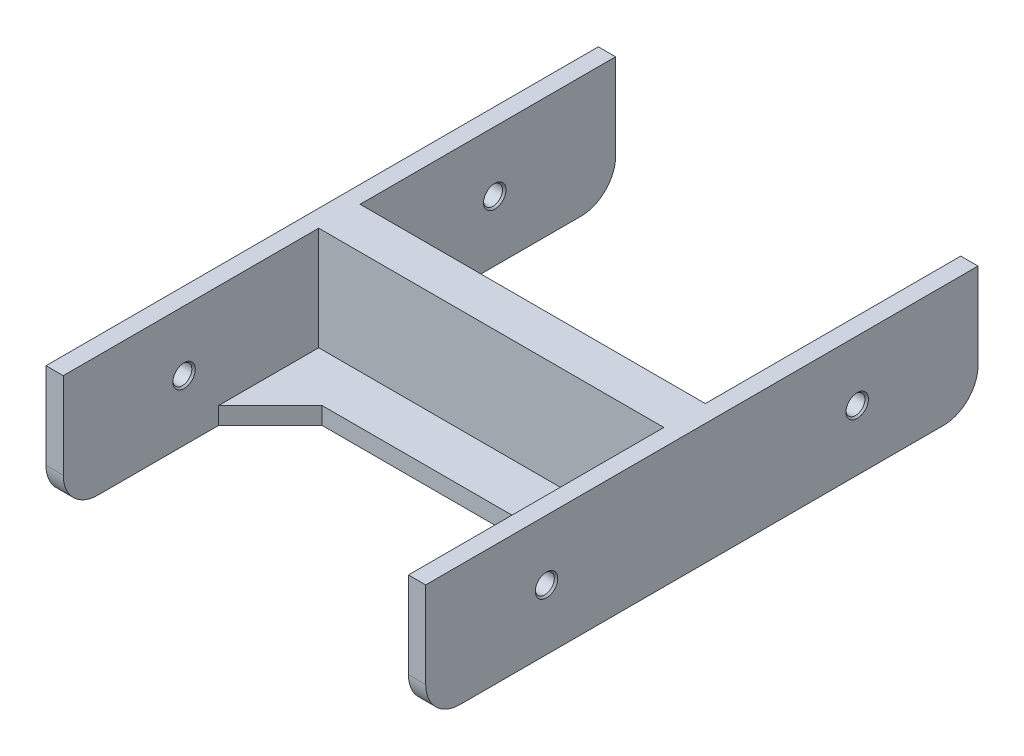
from build123d import *

# Parameters (mm, degrees)
SKETCH_1_W          = 160
SKETCH_1_H          = 20
EXTRUDE_1_DEPTH     = 5
EXTRUDE_3_DEPTH     = 100
SKETCH_5_W          = 12
SKETCH_5_H          = 15
EXTRUDE_4_DEPTH     = 105
SKETCH_6_W          = 74
SKETCH_6_H          = 15
EXTRUDE_5_DEPTH     = 5
SKETCH_7_W          = 160
SKETCH_7_H          = 35
EXTRUDE_6_DEPTH     = 5
EXTRUDE_7_DEPTH     = 5
SKETCH_9_R          = 2.75
CUT_EXTRUDE_1_DEPTH = 138.477270849
CHAMFER_1_SIZE      = 0.5
FILLET_1_R          = 10


with BuildPart() as part:
    # 草图1 → 凸台-拉伸1 (new body)
    with BuildSketch(Plane(origin=(0, 0, 0), x_dir=(0, 0, -1), z_dir=(1, 0, 0))):
        with Locations((0, -5)):
            Rectangle(SKETCH_1_W, SKETCH_1_H)
    extrude(amount=EXTRUDE_1_DEPTH)

    # 草图3 → 凸台-拉伸3 (add)
    with BuildSketch(Plane(origin=(5, 0, 0), x_dir=(0, 0, -1), z_dir=(1, 0, 0))):
        Polygon((-6, 5), (6, 5), (6, -10), (20, -10), (20, -15), (-20, -15), (-20, -10), (-6, -10), align=None)
    extrude(amount=EXTRUDE_3_DEPTH)

    # 草图5 → 凸台-拉伸4 (add)
    with BuildSketch(Plane.ZY):
        with Locations((0, 12.5)):
            Rectangle(SKETCH_5_W, SKETCH_5_H)
    extrude(amount=-EXTRUDE_4_DEPTH)

    # 草图6 → 凸台-拉伸5 (add)
    with BuildSketch(Plane.ZY):
        with Locations((43, 12.5)):
            Rectangle(SKETCH_6_W, SKETCH_6_H)
        with Locations((-43, 12.5)):
            Rectangle(SKETCH_6_W, SKETCH_6_H)
    extrude(amount=-EXTRUDE_5_DEPTH)

    # 草图7 → 凸台-拉伸6 (add)
    with BuildSketch(Plane(origin=(105, 0, 0), x_dir=(0, 0, -1), z_dir=(1, 0, 0))):
        with Locations((0, 2.5)):
            Rectangle(SKETCH_7_W, SKETCH_7_H)
    extrude(amount=EXTRUDE_6_DEPTH)

    # 草图8 → 凸台-拉伸7 (add)
    with BuildSketch(Plane.XZ.offset(15)):
        Polygon((90, 20), (105, 35), (105, 20), align=None)
        Polygon((105, -20), (90, -20), (105, -35), align=None)
        Polygon((5, 20), (20, 20), (5, 35), align=None)
        Polygon((20, -20), (5, -35), (5, -20), align=None)
    extrude(amount=-EXTRUDE_7_DEPTH)

    # 草图9 → 切除-拉伸1 (cut, through all)
    with BuildSketch(Plane(origin=(110, 0, 0), x_dir=(0, 0, -1), z_dir=(1, 0, 0))):
        with Locations((45, 2.5)):
            Circle(SKETCH_9_R)
        with Locations(Location((-45, 2.5, 0), (0, 0, 180))):
            Circle(SKETCH_9_R)
    extrude(amount=-CUT_EXTRUDE_1_DEPTH, mode=Mode.SUBTRACT)

    # 倒角1
    chamfer_1_edges = [part.edges().sort_by_distance(p)[0] for p in [
        (105, 2.5, -42.25),
        (5, 2.5, -42.25),
        (0, 2.5, -42.25),
        (110, 2.5, -42.25),
        (105, 2.5, 42.25),
        (5, 2.5, 42.25),
        (0, 2.5, 42.25),
        (110, 2.5, 42.25),
    ]]
    chamfer(chamfer_1_edges, length=CHAMFER_1_SIZE)

    # 圆角1
    fillet_1_edges = [part.edges().sort_by_distance(p)[0] for p in [
        (107.5, -15, 80),
        (107.5, -15, -80),
        (2.5, -15, -80),
        (2.5, -15, 80),
    ]]
    fillet(fillet_1_edges, radius=FILLET_1_R)


solid = part.part
